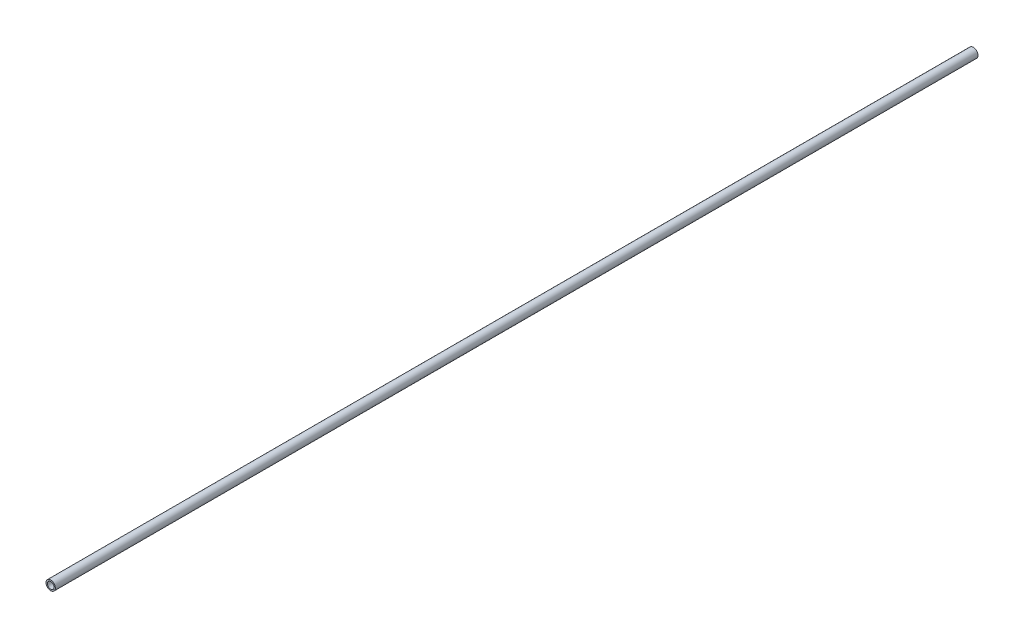
from build123d import *

# Parameters (mm, degrees)
SKETCH2_R           = 1.75
SKETCH2_R_2         = 1.25
BOSS_EXTRUDE1_DEPTH = 345


with BuildPart() as part:
    # Sketch2 → Boss-Extrude1 (new body)
    with BuildSketch(Plane.XY):
        Circle(SKETCH2_R)
        Circle(SKETCH2_R_2, mode=Mode.SUBTRACT)
    extrude(amount=-BOSS_EXTRUDE1_DEPTH)


solid = part.part
